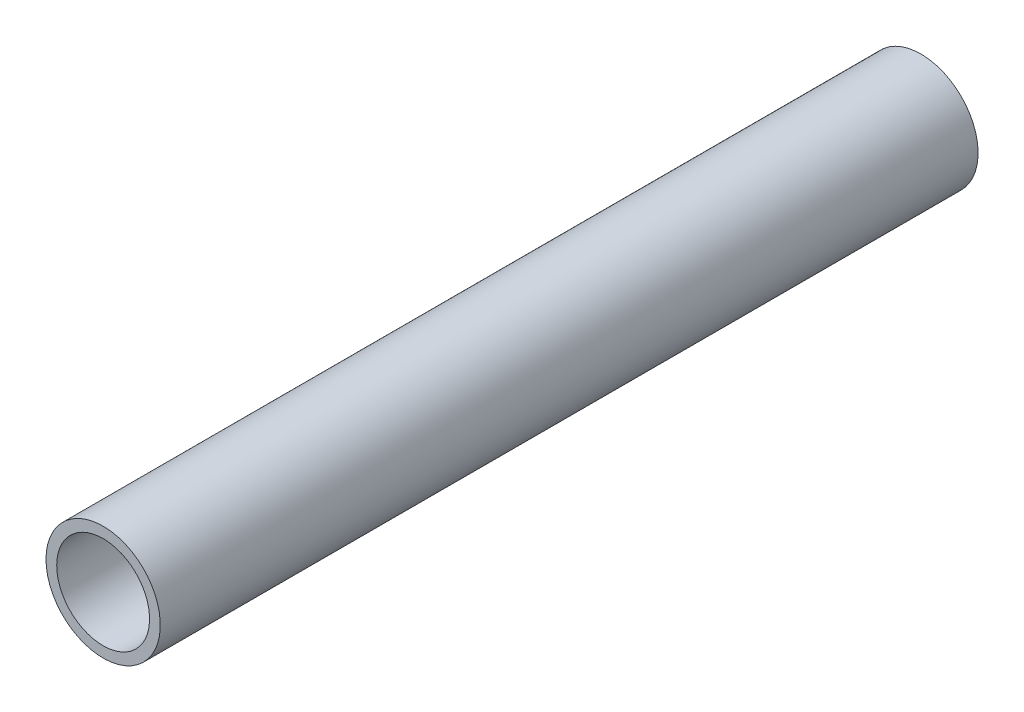
from build123d import *

# Parameters (mm, degrees)
CROQUIS1_R     = 16
EXTRUIR1_DEPTH = 114.5
VACIADO1_T     = -3


with BuildPart() as part:
    # Croquis1 → Extruir1 (new, symmetric)
    with BuildSketch(Plane.XY):
        with Locations(Location((0, 0, 0), (0, 0, 180))):
            Circle(CROQUIS1_R)
    extrude(amount=EXTRUIR1_DEPTH, both=True)

    # Vaciado1
    vaciado1_openings = [part.faces().sort_by_distance(p)[0] for p in [
        (0, 0, 114.5),
        (0, 0, -114.5),
    ]]
    offset(amount=VACIADO1_T, openings=vaciado1_openings, kind=Kind.INTERSECTION)


solid = part.part
